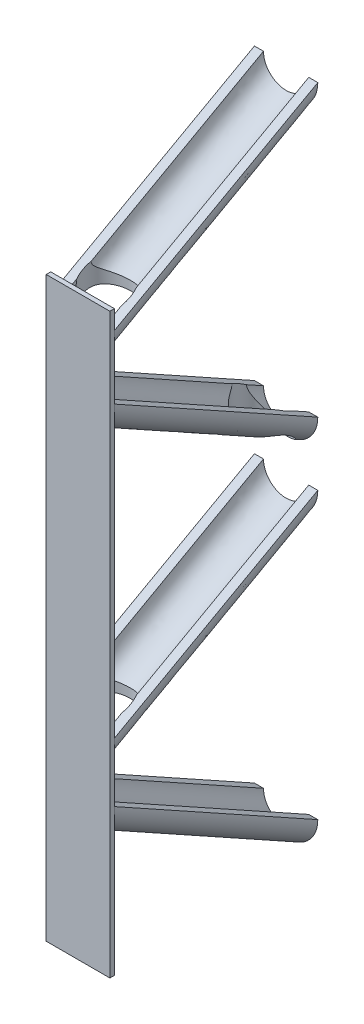
from build123d import *

# Parameters (mm, degrees)
SKETCH_29_R         = 5.25
CUT_EXTRUDE_5_DEPTH = 34
SKETCH_30_R         = 5.25
CUT_EXTRUDE_6_DEPTH = 34
SKETCH_31_R         = 5.25
CUT_EXTRUDE_7_DEPTH = 34
SKETCH_34_W         = 14.062866503
SKETCH_34_H         = 127.559649569
EXTRUDE_2_DEPTH     = 1


with BuildPart() as part:
    # 掃出5: sweep along a path in 草圖24
    with BuildLine(Plane(origin=(0, 0, 0), x_dir=(0, 0, -1), z_dir=(1, 0, 0))) as sweep_5_path:
        Line((0, -3.5), (-45, -28.5))
    # 草圖23 → 掃出5 (sweep)
    with BuildSketch(Plane.XY):
        with BuildLine():
            Line((-5, 0), (-7, 0))
            ThreePointArc((-7, 0), (0, -7), (7, 0))
            Line((7, 0), (5, 0))
            ThreePointArc((5, 0), (0, -5), (-5, 0))
        make_face()
    sweep(path=sweep_5_path.line)

    # 草圖30 → 除料-伸長6 (cut)
    with BuildSketch(Plane(origin=(0, 0, 0), x_dir=(1, 0, 0), z_dir=(0, 1, 0))):
        with Locations(Location((0, -39.65, 0), (0, 0, 270))):
            Circle(SKETCH_30_R)
    extrude(amount=-CUT_EXTRUDE_6_DEPTH, mode=Mode.SUBTRACT)



with BuildPart() as body_2:
    # 掃出6: sweep along a path in 草圖26
    with BuildLine(Plane(origin=(0, 0, 0), x_dir=(0, 0, -1), z_dir=(1, 0, 0))) as sweep_6_path:
        Line((-45, -42.5), (0, -67.5))
    # 草圖25 → 掃出6 (sweep)
    with BuildSketch(Plane.XY.offset(45)):
        with BuildLine():
            Line((7, -39), (5, -39))
            ThreePointArc((5, -39), (0, -44), (-5, -39))
            Line((-5, -39), (-7, -39))
            ThreePointArc((-7, -39), (0, -46), (7, -39))
        make_face()
    sweep(path=sweep_6_path.line)

    # 草圖29 → 除料-伸長5 (cut)
    with BuildSketch(Plane(origin=(0, -39, 0), x_dir=(1, 0, 0), z_dir=(0, 1, 0))):
        with Locations(Location((0, -5.35, 0), (0, 0, 270))):
            Circle(SKETCH_29_R)
    extrude(amount=-CUT_EXTRUDE_5_DEPTH, mode=Mode.SUBTRACT)


with BuildPart() as body_3:
    # 掃出7: sweep along a path in 草圖28
    with BuildLine(Plane(origin=(0, 0, 0), x_dir=(0, 0, -1), z_dir=(1, 0, 0))) as sweep_7_path:
        Line((0, -81.5), (-45, -106.5))
    # 草圖27 → 掃出7 (sweep)
    with BuildSketch(Plane(origin=(0, 0, 0), x_dir=(-1, 0, 0), z_dir=(0, 0, -1))):
        with BuildLine():
            Line((-7, -78), (-5, -78))
            ThreePointArc((-5, -78), (0, -83), (5, -78))
            Line((5, -78), (7, -78))
            ThreePointArc((7, -78), (0, -85), (-7, -78))
        make_face()
    sweep(path=sweep_7_path.line)

    # 草圖31 → 除料-伸長7 (cut)
    with BuildSketch(Plane(origin=(0, -78, 0), x_dir=(1, 0, 0), z_dir=(0, 1, 0))):
        with Locations(Location((0, -39.65, 0), (0, 0, 270))):
            Circle(SKETCH_31_R)
    extrude(amount=-CUT_EXTRUDE_7_DEPTH, mode=Mode.SUBTRACT)


with BuildPart() as body_4:
    # 掃出8: sweep along a path in 草圖33
    with BuildLine(Plane(origin=(0, 0, 0), x_dir=(0, 0, -1), z_dir=(1, 0, 0))) as sweep_8_path:
        Line((-45, -119.5), (0, -144.5))
    # 草圖32 → 掃出8 (sweep)
    with BuildSketch(Plane.XY.offset(45)):
        with BuildLine():
            Line((-7, -116), (-5, -116))
            ThreePointArc((-5, -116), (0, -121), (5, -116))
            Line((5, -116), (7, -116))
            ThreePointArc((7, -116), (0, -123), (-7, -116))
        make_face()
    sweep(path=sweep_8_path.line)


with BuildPart() as part_1:
    add(part.part)

    add(body_2.part)  # 填料-伸長2 merges body 2

    add(body_3.part)  # 填料-伸長2 merges body 3

    add(body_4.part)  # 填料-伸長2 merges body 4
    # 草圖34 → 填料-伸長2 (add)
    with BuildSketch(Plane.XY.offset(45)):
        with Locations((0.031433252, -84.487286626)):
            Rectangle(SKETCH_34_W, SKETCH_34_H)
    extrude(amount=EXTRUDE_2_DEPTH)


solid = part_1.part
